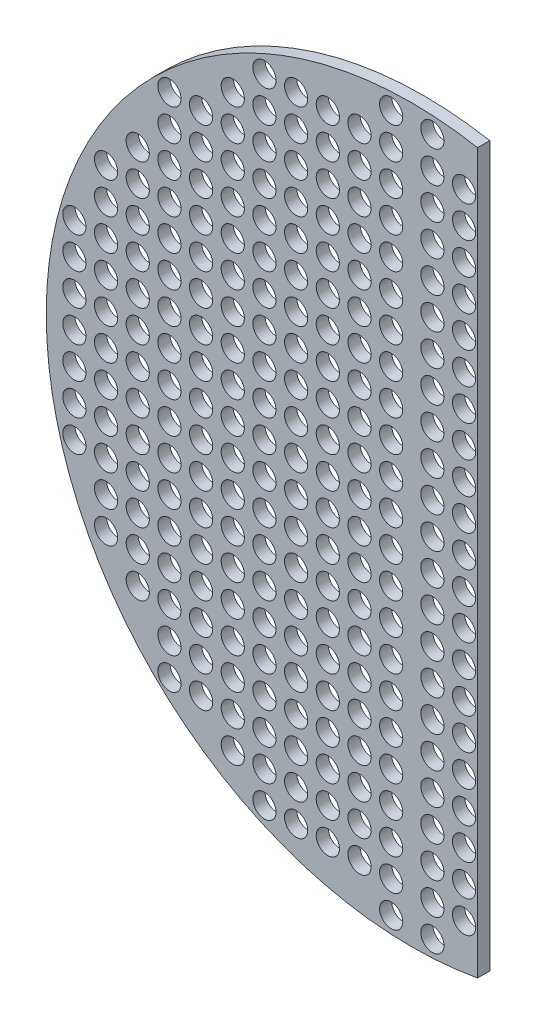
from build123d import *

# Parameters (mm, degrees)
SKETCH_1_R          = 300
EXTRUDE_1_DEPTH     = 5
CUT_EXTRUDE_2_DEPTH = 10
SKETCH1_R           = 9.525
CUT_EXTRUDE1_DEPTH  = 425.381903478


with BuildPart() as part:
    # Эскиз1 → Бобышка-Вытянуть1 (new, symmetric)
    with BuildSketch(Plane.XY):
        Circle(SKETCH_1_R)
    extrude(amount=EXTRUDE_1_DEPTH, both=True)

    # Эскиз3 → Вырез-Вытянуть2 (cut)
    with BuildSketch(Plane.XY.offset(5)):
        with BuildLine():
            Line((54, 295.099983057), (54, -295.099983057))
            ThreePointArc((54, -295.099983057), (300, 0), (54, 295.099983057))
        make_face()
    extrude(amount=-CUT_EXTRUDE_2_DEPTH, mode=Mode.SUBTRACT)

    # Sketch1 → Cut-Extrude1 (cut, through all)
    with BuildSketch(Plane.XY.offset(5)):
        with Locations((16.915767562, 0)):
            Circle(SKETCH1_R)
        with Locations((42.915767562, 0)):
            Circle(SKETCH1_R)
        with Locations((42.915767562, 26)):
            Circle(SKETCH1_R)
        with Locations((42.915767562, 52)):
            Circle(SKETCH1_R)
        with Locations((42.915767562, 78)):
            Circle(SKETCH1_R)
        with Locations((42.915767562, 104)):
            Circle(SKETCH1_R)
        with Locations(Location((16.915767562, -286, 0), (0, 0, 180))):
            Circle(SKETCH1_R)
        with Locations((42.915767562, 130)):
            Circle(SKETCH1_R)
        with Locations(Location((16.915767562, -260, 0), (0, 0, 180))):
            Circle(SKETCH1_R)
        with Locations((42.915767562, 156)):
            Circle(SKETCH1_R)
        with Locations(Location((16.915767562, -234, 0), (0, 0, 180))):
            Circle(SKETCH1_R)
        with Locations(Location((16.915767562, -208, 0), (0, 0, 180))):
            Circle(SKETCH1_R)
        with Locations((42.915767562, 182)):
            Circle(SKETCH1_R)
        with Locations(Location((16.915767562, -182, 0), (0, 0, 180))):
            Circle(SKETCH1_R)
        with Locations(Location((16.915767562, -156, 0), (0, 0, 180))):
            Circle(SKETCH1_R)
        with Locations(Location((16.915767562, -130, 0), (0, 0, 180))):
            Circle(SKETCH1_R)
        with Locations((42.915767562, 208)):
            Circle(SKETCH1_R)
        with Locations(Location((16.915767562, -104, 0), (0, 0, 180))):
            Circle(SKETCH1_R)
        with Locations(Location((16.915767562, -78, 0), (0, 0, 180))):
            Circle(SKETCH1_R)
        with Locations(Location((16.915767562, -52, 0), (0, 0, 180))):
            Circle(SKETCH1_R)
        with Locations((42.915767562, 234)):
            Circle(SKETCH1_R)
        with Locations(Location((16.915767562, -26, 0), (0, 0, 180))):
            Circle(SKETCH1_R)
        with Locations(Location((42.915767562, -260, 0), (0, 0, 180))):
            Circle(SKETCH1_R)
        with Locations((42.915767562, 260)):
            Circle(SKETCH1_R)
        with Locations(Location((42.915767562, -234, 0), (0, 0, 180))):
            Circle(SKETCH1_R)
        with Locations(Location((42.915767562, -208, 0), (0, 0, 180))):
            Circle(SKETCH1_R)
        with Locations((16.915767562, 26)):
            Circle(SKETCH1_R)
        with Locations((16.915767562, 52)):
            Circle(SKETCH1_R)
        with Locations((16.915767562, 78)):
            Circle(SKETCH1_R)
        with Locations((16.915767562, 104)):
            Circle(SKETCH1_R)
        with Locations((16.915767562, 130)):
            Circle(SKETCH1_R)
        with Locations((16.915767562, 156)):
            Circle(SKETCH1_R)
        with Locations((16.915767562, 182)):
            Circle(SKETCH1_R)
        with Locations((16.915767562, 208)):
            Circle(SKETCH1_R)
        with Locations((16.915767562, 234)):
            Circle(SKETCH1_R)
        with Locations((16.915767562, 260)):
            Circle(SKETCH1_R)
        with Locations((16.915767562, 286)):
            Circle(SKETCH1_R)
        with Locations(Location((42.915767562, -182, 0), (0, 0, 180))):
            Circle(SKETCH1_R)
        with Locations(Location((42.915767562, -156, 0), (0, 0, 180))):
            Circle(SKETCH1_R)
        with Locations(Location((42.915767562, -130, 0), (0, 0, 180))):
            Circle(SKETCH1_R)
        with Locations(Location((42.915767562, -104, 0), (0, 0, 180))):
            Circle(SKETCH1_R)
        with Locations(Location((42.915767562, -78, 0), (0, 0, 180))):
            Circle(SKETCH1_R)
        with Locations(Location((42.915767562, -52, 0), (0, 0, 180))):
            Circle(SKETCH1_R)
        with Locations(Location((42.915767562, -26, 0), (0, 0, 180))):
            Circle(SKETCH1_R)
        with Locations((-42.915767562, -26)):
            Circle(SKETCH1_R)
        with Locations((-68.915767562, -26)):
            Circle(SKETCH1_R)
        with Locations((-94.915767562, -26)):
            Circle(SKETCH1_R)
        with Locations((-120.915767562, -26)):
            Circle(SKETCH1_R)
        with Locations((-146.915767562, -26)):
            Circle(SKETCH1_R)
        with Locations((-172.915767562, -26)):
            Circle(SKETCH1_R)
        with Locations((-198.915767562, -26)):
            Circle(SKETCH1_R)
        with Locations((-224.915767562, -26)):
            Circle(SKETCH1_R)
        with Locations((-250.915767562, -26)):
            Circle(SKETCH1_R)
        with Locations((-276.915767562, -26)):
            Circle(SKETCH1_R)
        with Locations((-42.915767562, -52)):
            Circle(SKETCH1_R)
        with Locations((-68.915767562, -52)):
            Circle(SKETCH1_R)
        with Locations((-94.915767562, -52)):
            Circle(SKETCH1_R)
        with Locations((-120.915767562, -52)):
            Circle(SKETCH1_R)
        with Locations((-146.915767562, -52)):
            Circle(SKETCH1_R)
        with Locations((-172.915767562, -52)):
            Circle(SKETCH1_R)
        with Locations((-198.915767562, -52)):
            Circle(SKETCH1_R)
        with Locations((-224.915767562, -52)):
            Circle(SKETCH1_R)
        with Locations((-250.915767562, -52)):
            Circle(SKETCH1_R)
        with Locations((-276.915767562, -52)):
            Circle(SKETCH1_R)
        with Locations((-42.915767562, -78)):
            Circle(SKETCH1_R)
        with Locations((-68.915767562, -78)):
            Circle(SKETCH1_R)
        with Locations((-94.915767562, -78)):
            Circle(SKETCH1_R)
        with Locations((-120.915767562, -78)):
            Circle(SKETCH1_R)
        with Locations((-146.915767562, -78)):
            Circle(SKETCH1_R)
        with Locations((-172.915767562, -78)):
            Circle(SKETCH1_R)
        with Locations((-198.915767562, -78)):
            Circle(SKETCH1_R)
        with Locations((-224.915767562, -78)):
            Circle(SKETCH1_R)
        with Locations((-250.915767562, -78)):
            Circle(SKETCH1_R)
        with Locations((-276.915767562, -78)):
            Circle(SKETCH1_R)
        with Locations((-42.915767562, -104)):
            Circle(SKETCH1_R)
        with Locations((-68.915767562, -104)):
            Circle(SKETCH1_R)
        with Locations((-94.915767562, -104)):
            Circle(SKETCH1_R)
        with Locations((-120.915767562, -104)):
            Circle(SKETCH1_R)
        with Locations((-146.915767562, -104)):
            Circle(SKETCH1_R)
        with Locations((-172.915767562, -104)):
            Circle(SKETCH1_R)
        with Locations((-198.915767562, -104)):
            Circle(SKETCH1_R)
        with Locations((-224.915767562, -104)):
            Circle(SKETCH1_R)
        with Locations((-250.915767562, -104)):
            Circle(SKETCH1_R)
        with Locations((-42.915767562, -130)):
            Circle(SKETCH1_R)
        with Locations((-68.915767562, -130)):
            Circle(SKETCH1_R)
        with Locations((-94.915767562, -130)):
            Circle(SKETCH1_R)
        with Locations((-120.915767562, -130)):
            Circle(SKETCH1_R)
        with Locations((-146.915767562, -130)):
            Circle(SKETCH1_R)
        with Locations((-172.915767562, -130)):
            Circle(SKETCH1_R)
        with Locations((-198.915767562, -130)):
            Circle(SKETCH1_R)
        with Locations((-224.915767562, -130)):
            Circle(SKETCH1_R)
        with Locations((-250.915767562, -130)):
            Circle(SKETCH1_R)
        with Locations((-42.915767562, -156)):
            Circle(SKETCH1_R)
        with Locations((-68.915767562, -156)):
            Circle(SKETCH1_R)
        with Locations((-94.915767562, -156)):
            Circle(SKETCH1_R)
        with Locations((-120.915767562, -156)):
            Circle(SKETCH1_R)
        with Locations((-146.915767562, -156)):
            Circle(SKETCH1_R)
        with Locations((-172.915767562, -156)):
            Circle(SKETCH1_R)
        with Locations((-198.915767562, -156)):
            Circle(SKETCH1_R)
        with Locations((-224.915767562, -156)):
            Circle(SKETCH1_R)
        with Locations((-42.915767562, -182)):
            Circle(SKETCH1_R)
        with Locations((-68.915767562, -182)):
            Circle(SKETCH1_R)
        with Locations((-94.915767562, -182)):
            Circle(SKETCH1_R)
        with Locations(Location((-16.915767562, 286, 0), (0, 0, 180))):
            Circle(SKETCH1_R)
        with Locations(Location((-16.915767562, 260, 0), (0, 0, 180))):
            Circle(SKETCH1_R)
        with Locations(Location((-16.915767562, 234, 0), (0, 0, 180))):
            Circle(SKETCH1_R)
        with Locations(Location((-16.915767562, 208, 0), (0, 0, 180))):
            Circle(SKETCH1_R)
        with Locations(Location((-16.915767562, 182, 0), (0, 0, 180))):
            Circle(SKETCH1_R)
        with Locations(Location((-16.915767562, 156, 0), (0, 0, 180))):
            Circle(SKETCH1_R)
        with Locations(Location((-16.915767562, 130, 0), (0, 0, 180))):
            Circle(SKETCH1_R)
        with Locations(Location((-16.915767562, 104, 0), (0, 0, 180))):
            Circle(SKETCH1_R)
        with Locations(Location((-16.915767562, 78, 0), (0, 0, 180))):
            Circle(SKETCH1_R)
        with Locations(Location((-16.915767562, 52, 0), (0, 0, 180))):
            Circle(SKETCH1_R)
        with Locations(Location((-16.915767562, 26, 0), (0, 0, 180))):
            Circle(SKETCH1_R)
        with Locations((-120.915767562, -182)):
            Circle(SKETCH1_R)
        with Locations((-146.915767562, -182)):
            Circle(SKETCH1_R)
        with Locations((-172.915767562, -182)):
            Circle(SKETCH1_R)
        with Locations((-198.915767562, -182)):
            Circle(SKETCH1_R)
        with Locations((-42.915767562, -208)):
            Circle(SKETCH1_R)
        with Locations((-68.915767562, -208)):
            Circle(SKETCH1_R)
        with Locations((-94.915767562, -208)):
            Circle(SKETCH1_R)
        with Locations((-120.915767562, -208)):
            Circle(SKETCH1_R)
        with Locations((-146.915767562, -208)):
            Circle(SKETCH1_R)
        with Locations((-172.915767562, -208)):
            Circle(SKETCH1_R)
        with Locations((-198.915767562, -208)):
            Circle(SKETCH1_R)
        with Locations((-42.915767562, -234)):
            Circle(SKETCH1_R)
        with Locations((-68.915767562, -234)):
            Circle(SKETCH1_R)
        with Locations((-94.915767562, -234)):
            Circle(SKETCH1_R)
        with Locations((-120.915767562, -234)):
            Circle(SKETCH1_R)
        with Locations((-146.915767562, -234)):
            Circle(SKETCH1_R)
        with Locations(Location((-120.915767562, 260, 0), (0, 0, 180))):
            Circle(SKETCH1_R)
        with Locations(Location((-94.915767562, 260, 0), (0, 0, 180))):
            Circle(SKETCH1_R)
        with Locations(Location((-68.915767562, 260, 0), (0, 0, 180))):
            Circle(SKETCH1_R)
        with Locations(Location((-42.915767562, 260, 0), (0, 0, 180))):
            Circle(SKETCH1_R)
        with Locations((-42.915767562, -260)):
            Circle(SKETCH1_R)
        with Locations((-68.915767562, -260)):
            Circle(SKETCH1_R)
        with Locations((-94.915767562, -260)):
            Circle(SKETCH1_R)
        with Locations((-120.915767562, -260)):
            Circle(SKETCH1_R)
        with Locations((-16.915767562, -26)):
            Circle(SKETCH1_R)
        with Locations(Location((-146.915767562, 234, 0), (0, 0, 180))):
            Circle(SKETCH1_R)
        with Locations(Location((-120.915767562, 234, 0), (0, 0, 180))):
            Circle(SKETCH1_R)
        with Locations(Location((-94.915767562, 234, 0), (0, 0, 180))):
            Circle(SKETCH1_R)
        with Locations(Location((-68.915767562, 234, 0), (0, 0, 180))):
            Circle(SKETCH1_R)
        with Locations(Location((-42.915767562, 234, 0), (0, 0, 180))):
            Circle(SKETCH1_R)
        with Locations((-16.915767562, -52)):
            Circle(SKETCH1_R)
        with Locations((-16.915767562, -78)):
            Circle(SKETCH1_R)
        with Locations((-16.915767562, -104)):
            Circle(SKETCH1_R)
        with Locations(Location((-198.915767562, 208, 0), (0, 0, 180))):
            Circle(SKETCH1_R)
        with Locations(Location((-172.915767562, 208, 0), (0, 0, 180))):
            Circle(SKETCH1_R)
        with Locations(Location((-146.915767562, 208, 0), (0, 0, 180))):
            Circle(SKETCH1_R)
        with Locations(Location((-120.915767562, 208, 0), (0, 0, 180))):
            Circle(SKETCH1_R)
        with Locations(Location((-94.915767562, 208, 0), (0, 0, 180))):
            Circle(SKETCH1_R)
        with Locations(Location((-68.915767562, 208, 0), (0, 0, 180))):
            Circle(SKETCH1_R)
        with Locations(Location((-42.915767562, 208, 0), (0, 0, 180))):
            Circle(SKETCH1_R)
        with Locations((-16.915767562, -130)):
            Circle(SKETCH1_R)
        with Locations((-16.915767562, -156)):
            Circle(SKETCH1_R)
        with Locations((-16.915767562, -182)):
            Circle(SKETCH1_R)
        with Locations(Location((-198.915767562, 182, 0), (0, 0, 180))):
            Circle(SKETCH1_R)
        with Locations(Location((-172.915767562, 182, 0), (0, 0, 180))):
            Circle(SKETCH1_R)
        with Locations(Location((-146.915767562, 182, 0), (0, 0, 180))):
            Circle(SKETCH1_R)
        with Locations(Location((-120.915767562, 182, 0), (0, 0, 180))):
            Circle(SKETCH1_R)
        with Locations(Location((-94.915767562, 182, 0), (0, 0, 180))):
            Circle(SKETCH1_R)
        with Locations(Location((-68.915767562, 182, 0), (0, 0, 180))):
            Circle(SKETCH1_R)
        with Locations(Location((-42.915767562, 182, 0), (0, 0, 180))):
            Circle(SKETCH1_R)
        with Locations((-16.915767562, -208)):
            Circle(SKETCH1_R)
        with Locations((-16.915767562, -234)):
            Circle(SKETCH1_R)
        with Locations(Location((-224.915767562, 156, 0), (0, 0, 180))):
            Circle(SKETCH1_R)
        with Locations(Location((-198.915767562, 156, 0), (0, 0, 180))):
            Circle(SKETCH1_R)
        with Locations(Location((-172.915767562, 156, 0), (0, 0, 180))):
            Circle(SKETCH1_R)
        with Locations(Location((-146.915767562, 156, 0), (0, 0, 180))):
            Circle(SKETCH1_R)
        with Locations(Location((-120.915767562, 156, 0), (0, 0, 180))):
            Circle(SKETCH1_R)
        with Locations(Location((-94.915767562, 156, 0), (0, 0, 180))):
            Circle(SKETCH1_R)
        with Locations(Location((-68.915767562, 156, 0), (0, 0, 180))):
            Circle(SKETCH1_R)
        with Locations(Location((-42.915767562, 156, 0), (0, 0, 180))):
            Circle(SKETCH1_R)
        with Locations((-16.915767562, -260)):
            Circle(SKETCH1_R)
        with Locations(Location((-250.915767562, 130, 0), (0, 0, 180))):
            Circle(SKETCH1_R)
        with Locations(Location((-224.915767562, 130, 0), (0, 0, 180))):
            Circle(SKETCH1_R)
        with Locations(Location((-198.915767562, 130, 0), (0, 0, 180))):
            Circle(SKETCH1_R)
        with Locations(Location((-172.915767562, 130, 0), (0, 0, 180))):
            Circle(SKETCH1_R)
        with Locations(Location((-146.915767562, 130, 0), (0, 0, 180))):
            Circle(SKETCH1_R)
        with Locations(Location((-120.915767562, 130, 0), (0, 0, 180))):
            Circle(SKETCH1_R)
        with Locations(Location((-94.915767562, 130, 0), (0, 0, 180))):
            Circle(SKETCH1_R)
        with Locations(Location((-68.915767562, 130, 0), (0, 0, 180))):
            Circle(SKETCH1_R)
        with Locations(Location((-42.915767562, 130, 0), (0, 0, 180))):
            Circle(SKETCH1_R)
        with Locations((-16.915767562, -286)):
            Circle(SKETCH1_R)
        with Locations(Location((-250.915767562, 104, 0), (0, 0, 180))):
            Circle(SKETCH1_R)
        with Locations(Location((-224.915767562, 104, 0), (0, 0, 180))):
            Circle(SKETCH1_R)
        with Locations(Location((-198.915767562, 104, 0), (0, 0, 180))):
            Circle(SKETCH1_R)
        with Locations(Location((-172.915767562, 104, 0), (0, 0, 180))):
            Circle(SKETCH1_R)
        with Locations(Location((-146.915767562, 104, 0), (0, 0, 180))):
            Circle(SKETCH1_R)
        with Locations(Location((-120.915767562, 104, 0), (0, 0, 180))):
            Circle(SKETCH1_R)
        with Locations(Location((-94.915767562, 104, 0), (0, 0, 180))):
            Circle(SKETCH1_R)
        with Locations(Location((-68.915767562, 104, 0), (0, 0, 180))):
            Circle(SKETCH1_R)
        with Locations(Location((-42.915767562, 104, 0), (0, 0, 180))):
            Circle(SKETCH1_R)
        with Locations(Location((-276.915767562, 78, 0), (0, 0, 180))):
            Circle(SKETCH1_R)
        with Locations(Location((-250.915767562, 78, 0), (0, 0, 180))):
            Circle(SKETCH1_R)
        with Locations(Location((-224.915767562, 78, 0), (0, 0, 180))):
            Circle(SKETCH1_R)
        with Locations(Location((-198.915767562, 78, 0), (0, 0, 180))):
            Circle(SKETCH1_R)
        with Locations(Location((-172.915767562, 78, 0), (0, 0, 180))):
            Circle(SKETCH1_R)
        with Locations(Location((-146.915767562, 78, 0), (0, 0, 180))):
            Circle(SKETCH1_R)
        with Locations(Location((-120.915767562, 78, 0), (0, 0, 180))):
            Circle(SKETCH1_R)
        with Locations(Location((-94.915767562, 78, 0), (0, 0, 180))):
            Circle(SKETCH1_R)
        with Locations(Location((-68.915767562, 78, 0), (0, 0, 180))):
            Circle(SKETCH1_R)
        with Locations(Location((-42.915767562, 78, 0), (0, 0, 180))):
            Circle(SKETCH1_R)
        with Locations(Location((-276.915767562, 52, 0), (0, 0, 180))):
            Circle(SKETCH1_R)
        with Locations(Location((-250.915767562, 52, 0), (0, 0, 180))):
            Circle(SKETCH1_R)
        with Locations(Location((-224.915767562, 52, 0), (0, 0, 180))):
            Circle(SKETCH1_R)
        with Locations(Location((-198.915767562, 52, 0), (0, 0, 180))):
            Circle(SKETCH1_R)
        with Locations(Location((-172.915767562, 52, 0), (0, 0, 180))):
            Circle(SKETCH1_R)
        with Locations(Location((-146.915767562, 52, 0), (0, 0, 180))):
            Circle(SKETCH1_R)
        with Locations(Location((-120.915767562, 52, 0), (0, 0, 180))):
            Circle(SKETCH1_R)
        with Locations(Location((-94.915767562, 52, 0), (0, 0, 180))):
            Circle(SKETCH1_R)
        with Locations(Location((-68.915767562, 52, 0), (0, 0, 180))):
            Circle(SKETCH1_R)
        with Locations(Location((-42.915767562, 52, 0), (0, 0, 180))):
            Circle(SKETCH1_R)
        with Locations(Location((-276.915767562, 26, 0), (0, 0, 180))):
            Circle(SKETCH1_R)
        with Locations(Location((-250.915767562, 26, 0), (0, 0, 180))):
            Circle(SKETCH1_R)
        with Locations(Location((-224.915767562, 26, 0), (0, 0, 180))):
            Circle(SKETCH1_R)
        with Locations(Location((-198.915767562, 26, 0), (0, 0, 180))):
            Circle(SKETCH1_R)
        with Locations(Location((-172.915767562, 26, 0), (0, 0, 180))):
            Circle(SKETCH1_R)
        with Locations(Location((-146.915767562, 26, 0), (0, 0, 180))):
            Circle(SKETCH1_R)
        with Locations(Location((-120.915767562, 26, 0), (0, 0, 180))):
            Circle(SKETCH1_R)
        with Locations(Location((-94.915767562, 26, 0), (0, 0, 180))):
            Circle(SKETCH1_R)
        with Locations(Location((-68.915767562, 26, 0), (0, 0, 180))):
            Circle(SKETCH1_R)
        with Locations(Location((-42.915767562, 26, 0), (0, 0, 180))):
            Circle(SKETCH1_R)
        with Locations(Location((-276.915767562, 0, 0), (0, 0, 180))):
            Circle(SKETCH1_R)
        with Locations(Location((-250.915767562, 0, 0), (0, 0, 180))):
            Circle(SKETCH1_R)
        with Locations(Location((-224.915767562, 0, 0), (0, 0, 180))):
            Circle(SKETCH1_R)
        with Locations(Location((-198.915767562, 0, 0), (0, 0, 180))):
            Circle(SKETCH1_R)
        with Locations(Location((-172.915767562, 0, 0), (0, 0, 180))):
            Circle(SKETCH1_R)
        with Locations(Location((-146.915767562, 0, 0), (0, 0, 180))):
            Circle(SKETCH1_R)
        with Locations(Location((-120.915767562, 0, 0), (0, 0, 180))):
            Circle(SKETCH1_R)
        with Locations(Location((-94.915767562, 0, 0), (0, 0, 180))):
            Circle(SKETCH1_R)
        with Locations(Location((-68.915767562, 0, 0), (0, 0, 180))):
            Circle(SKETCH1_R)
        with Locations(Location((-42.915767562, 0, 0), (0, 0, 180))):
            Circle(SKETCH1_R)
        with Locations(Location((-16.915767562, 0, 0), (0, 0, 180))):
            Circle(SKETCH1_R)
    extrude(amount=-CUT_EXTRUDE1_DEPTH, mode=Mode.SUBTRACT)


solid = part.part
